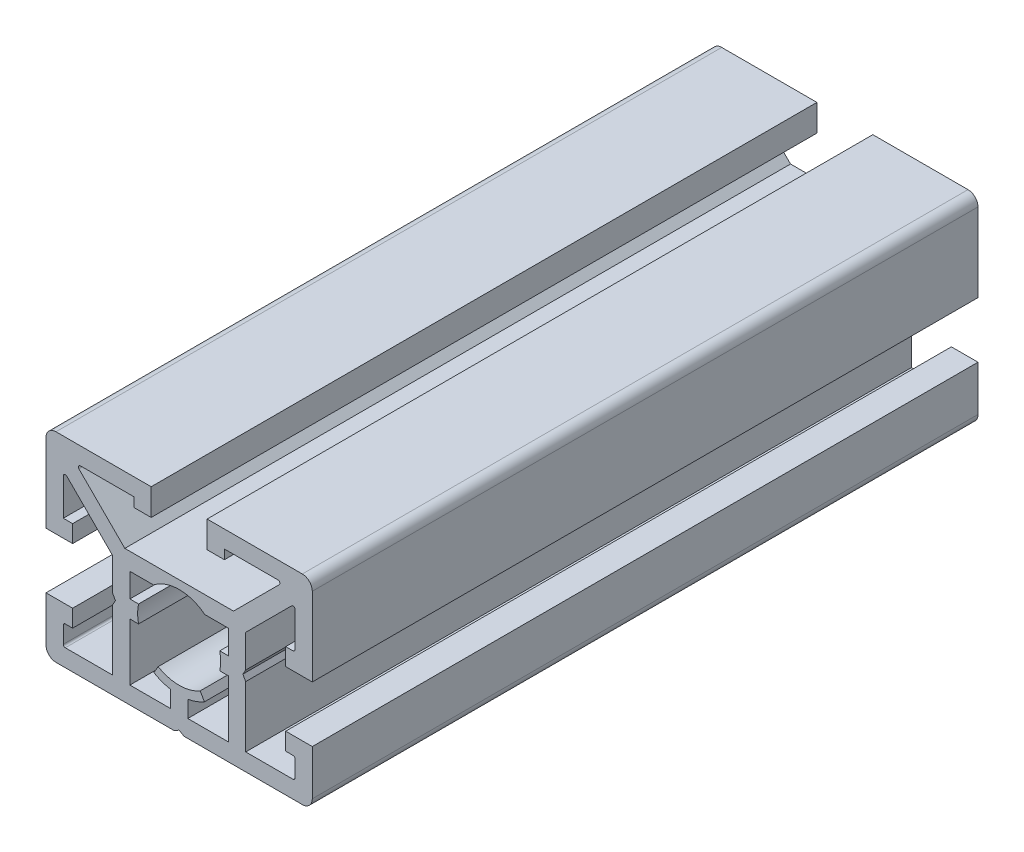
from build123d import *

# Parameters (mm, degrees)
EXTRUDE_1_DEPTH = 100


with BuildPart() as part:
    # 草图1 → 凸台-拉伸1 (new body)
    with BuildSketch(Plane.XY):
        with BuildLine():
            Line((-17.468782805, -13.940182328), (0.281217195, -13.940182328))
            Line((0.281217195, -13.940182328), (1.031217195, -13.507169626))
            Line((1.031217195, -13.507169626), (1.781217195, -13.940182328))
            Line((1.781217195, -13.940182328), (19.531217195, -13.940182328))
            ThreePointArc((19.531217195, -13.940182328), (20.591877367, -13.5008425), (21.031217195, -12.440182328))
            Line((21.031217195, -12.440182328), (21.031217195, -5.640182328))
            Line((21.031217195, -5.640182328), (17.031217195, -5.640182328))
            Line((17.031217195, -5.640182328), (17.031217195, -8.240182328))
            Line((17.031217195, -8.240182328), (18.131217195, -8.240182328))
            ThreePointArc((18.131217195, -8.240182328), (18.343349229, -8.328050294), (18.431217195, -8.540182328))
            Line((18.431217195, -8.540182328), (18.431217195, -11.040182328))
            ThreePointArc((18.431217195, -11.040182328), (18.343349229, -11.252314363), (18.131217195, -11.340182328))
            Line((18.131217195, -11.340182328), (11.031217195, -11.340182328))
            Line((11.031217195, -11.340182328), (11.031217195, -2.190182328))
            Line((11.031217195, -2.190182328), (10.598204493, -1.440182328))
            Line((10.598204493, -1.440182328), (11.031217195, -0.690182328))
            Line((11.031217195, -0.690182328), (11.031217195, 4.221340041))
            Line((11.031217195, 4.221340041), (17.919085161, 11.109208006))
            ThreePointArc((17.919085161, 11.109208006), (18.246022225, 11.174239832), (18.431217195, 10.897075972))
            Line((18.431217195, 10.897075972), (18.431217195, 5.659817672))
            ThreePointArc((18.431217195, 5.659817672), (18.343349229, 5.447685637), (18.131217195, 5.359817672))
            Line((18.131217195, 5.359817672), (17.031217195, 5.359817672))
            Line((17.031217195, 5.359817672), (17.031217195, 2.759817672))
            Line((17.031217195, 2.759817672), (21.031217195, 2.759817672))
            Line((21.031217195, 2.759817672), (21.031217195, 14.559817672))
            ThreePointArc((21.031217195, 14.559817672), (20.591877367, 15.620477844), (19.531217195, 16.059817672))
            Line((19.531217195, 16.059817672), (5.231217195, 16.059817672))
            Line((5.231217195, 16.059817672), (5.231217195, 12.059817672))
            Line((5.231217195, 12.059817672), (7.831217195, 12.059817672))
            Line((7.831217195, 12.059817672), (7.831217195, 13.459817672))
            Line((7.831217195, 13.459817672), (15.868475495, 13.459817672))
            ThreePointArc((15.868475495, 13.459817672), (16.145639355, 13.274622702), (16.080607529, 12.947685637))
            Line((16.080607529, 12.947685637), (9.192739564, 6.059817672))
            Line((9.192739564, 6.059817672), (-7.130305174, 6.059817672))
            Line((-7.130305174, 6.059817672), (-14.01817314, 12.947685637))
            ThreePointArc((-14.01817314, 12.947685637), (-14.083204965, 13.274622702), (-13.806041105, 13.459817672))
            Line((-13.806041105, 13.459817672), (-5.768782805, 13.459817672))
            Line((-5.768782805, 13.459817672), (-5.768782805, 12.059817672))
            Line((-5.768782805, 12.059817672), (-3.168782805, 12.059817672))
            Line((-3.168782805, 12.059817672), (-3.168782805, 16.059817672))
            Line((-3.168782805, 16.059817672), (-17.468782805, 16.059817672))
            ThreePointArc((-17.468782805, 16.059817672), (-18.529442977, 15.620477844), (-18.968782805, 14.559817672))
            Line((-18.968782805, 14.559817672), (-18.968782805, 2.759817672))
            Line((-18.968782805, 2.759817672), (-14.968782805, 2.759817672))
            Line((-14.968782805, 2.759817672), (-14.968782805, 5.359817672))
            Line((-14.968782805, 5.359817672), (-16.368782805, 5.359817672))
            Line((-16.368782805, 5.359817672), (-16.368782805, 10.897075972))
            ThreePointArc((-16.368782805, 10.897075972), (-16.183587835, 11.174239832), (-15.856650771, 11.109208006))
            Line((-15.856650771, 11.109208006), (-8.968782805, 4.221340041))
            Line((-8.968782805, 4.221340041), (-8.968782805, -0.690182328))
            Line((-8.968782805, -0.690182328), (-8.535770103, -1.440182328))
            Line((-8.535770103, -1.440182328), (-8.968782805, -2.190182328))
            Line((-8.968782805, -2.190182328), (-8.968782805, -11.340182328))
            Line((-8.968782805, -11.340182328), (-16.068782805, -11.340182328))
            ThreePointArc((-16.068782805, -11.340182328), (-16.280914839, -11.252314363), (-16.368782805, -11.040182328))
            Line((-16.368782805, -11.040182328), (-16.368782805, -8.540182328))
            ThreePointArc((-16.368782805, -8.540182328), (-16.280914839, -8.328050294), (-16.068782805, -8.240182328))
            Line((-16.068782805, -8.240182328), (-14.968782805, -8.240182328))
            Line((-14.968782805, -8.240182328), (-14.968782805, -5.640182328))
            Line((-14.968782805, -5.640182328), (-18.968782805, -5.640182328))
            Line((-18.968782805, -5.640182328), (-18.968782805, -12.440182328))
            ThreePointArc((-18.968782805, -12.440182328), (-18.529442977, -13.5008425), (-17.468782805, -13.940182328))
        make_face()
        with BuildLine():
            Line((-6.368782805, 3.459817672), (-2.827539081, 3.459817672))
            ThreePointArc((-2.827539081, 3.459817672), (1.031217195, 4.796804124), (4.889973471, 3.459817672))
            Line((4.889973471, 3.459817672), (8.431217195, 3.459817672))
            Line((8.431217195, 3.459817672), (8.431217195, -0.140182328))
            Line((8.431217195, -0.140182328), (7.131217195, -0.140182328))
            ThreePointArc((7.131217195, -0.140182328), (7.268203647, -1.440182328), (7.131217195, -2.740182328))
            Line((7.131217195, -2.740182328), (8.431217195, -2.740182328))
            Line((8.431217195, -2.740182328), (8.431217195, -11.340182328))
            Line((8.431217195, -11.340182328), (2.331217195, -11.340182328))
            Line((2.331217195, -11.340182328), (2.331217195, -8.840182328))
            ThreePointArc((2.331217195, -8.840182328), (3.622241119, -8.492600001), (4.831217195, -7.921694497))
            Line((4.831217195, -7.921694497), (4.18568736, -6.82063937))
            ThreePointArc((4.18568736, -6.82063937), (1.031217195, -7.67716878), (-2.12325297, -6.82063937))
            Line((-2.12325297, -6.82063937), (-2.768782805, -7.921694497))
            ThreePointArc((-2.768782805, -7.921694497), (-1.559806729, -8.492600001), (-0.268782805, -8.840182328))
            Line((-0.268782805, -8.840182328), (-0.268782805, -11.340182328))
            Line((-0.268782805, -11.340182328), (-6.368782805, -11.340182328))
            Line((-6.368782805, -11.340182328), (-6.368782805, -2.740182328))
            Line((-6.368782805, -2.740182328), (-5.068782805, -2.740182328))
            ThreePointArc((-5.068782805, -2.740182328), (-5.205769257, -1.440182328), (-5.068782805, -0.140182328))
            Line((-5.068782805, -0.140182328), (-6.368782805, -0.140182328))
            Line((-6.368782805, -0.140182328), (-6.368782805, 3.459817672))
        make_face(mode=Mode.SUBTRACT)
    extrude(amount=EXTRUDE_1_DEPTH)


solid = part.part
